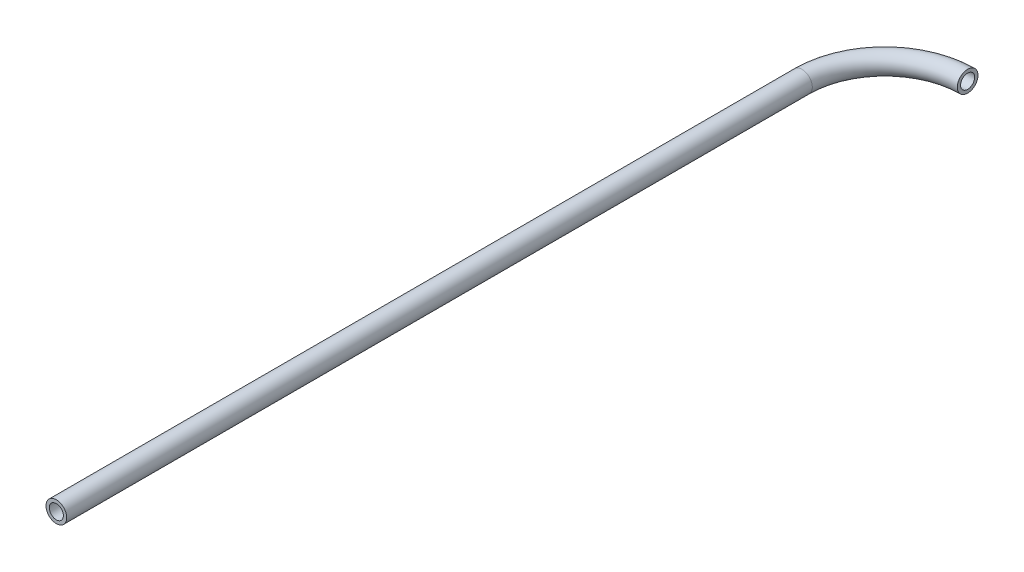
from build123d import *

# Parameters (mm, degrees)
SKETCH4_R   = 3.175
SKETCH4_R_2 = 2.159


with BuildPart() as part:
    # Sweep1: sweep along a path in Sketch1
    with BuildLine(Plane(origin=(0, 0, 0), x_dir=(1, 0, 0), z_dir=(0, 1, 0))) as sweep1_path:
        Line((-51.742950545, -120.91989474), (-51.742950545, 107.68010526))
        ThreePointArc((-51.742950545, 107.68010526), (-44.303462787, 125.640617502), (-26.342950545, 133.08010526))
    # Sketch4 → Sweep1 (sweep)
    with BuildSketch(Plane(origin=(-51.742950545, 0, 120.91989474), x_dir=(1, 0, 0), z_dir=(0, 0, 1))):
        Circle(SKETCH4_R)
        Circle(SKETCH4_R_2, mode=Mode.SUBTRACT)
    sweep(path=sweep1_path.line)


solid = part.part
